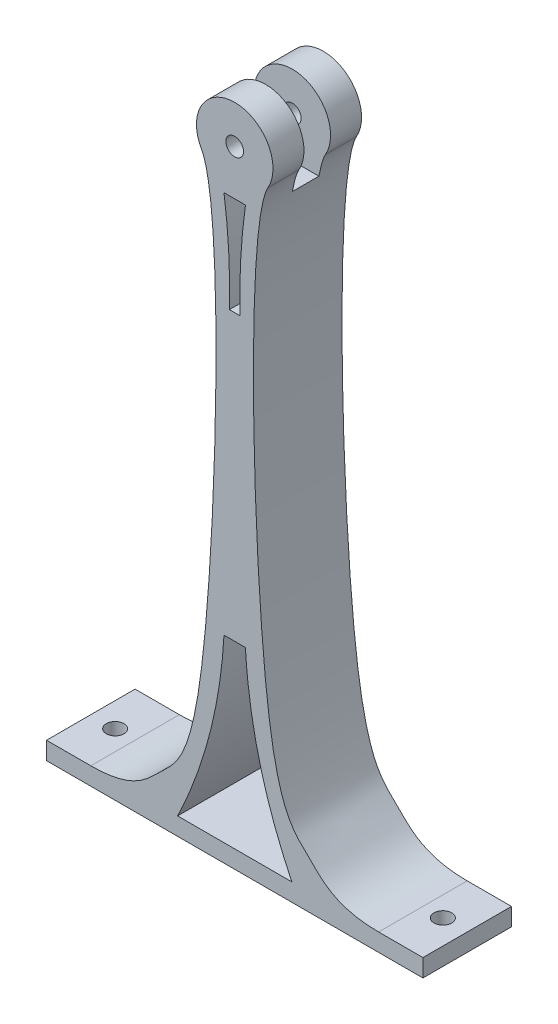
from build123d import *

# Parameters (mm, degrees)
SALIENTE_EXTRUIR2_DEPTH = 20
CROQUIS3_R              = 2
CORTAR_EXTRUIR1_DEPTH   = 158.182219231
CROQUIS7_W              = 30
CROQUIS7_H              = 6
CORTAR_EXTRUIR4_DEPTH   = 15
CROQUIS8_W              = 17.284402488
CROQUIS8_H              = 6
CORTAR_EXTRUIR5_DEPTH   = 5
CROQUIS6_R              = 2
CORTAR_EXTRUIR3_DEPTH   = 154.369651632


with BuildPart() as part:
    # Croquis1 → Saliente-Extruir2 (new body)
    with BuildSketch(Plane.XY):
        with BuildLine():
            Line((-42.5, 0), (-42.5, 4))
            Line((-42.5, 4), (-32.5, 4))
            add(Edge.make_bspline(
                [(-32.5, 4), (-22.670639358, 4), (-16.226990124, 12.301218675), (-5.122390032, 19.11443447), (-2.364282608, 128.09353499), (-7.5, 137.063891171)],
                knots=[0, 0, 0, 0, 0.22919519, 0.488952723, 0.855764583, 0.855764583, 0.855764583, 0.855764583], degree=3))
            ThreePointArc((-7.5, 137.063891171), (0, 150), (7.5, 137.063891171))
            add(Edge.make_bspline(
                [(32.5, 4), (22.670639358, 4), (16.226990124, 12.301218675), (5.122390032, 19.11443447), (2.364282608, 128.09353499), (7.5, 137.063891171)],
                knots=[0, 0, 0, 0, 0.22919519, 0.488952723, 0.855764583, 0.855764583, 0.855764583, 0.855764583], degree=3))
            Line((32.5, 4), (42.5, 4))
            Line((42.5, 4), (42.5, 0))
            Line((42.5, 0), (-42.5, 0))
        make_face()
    extrude(amount=SALIENTE_EXTRUIR2_DEPTH)

    # Croquis3 → Cortar-Extruir1 (cut, through all)
    with BuildSketch(Plane.XY.offset(20)):
        with Locations((0, 141.357798756)):
            Circle(CROQUIS3_R)
        with BuildLine():
            Line((-2.421642236, 44.591389295), (2.421642236, 44.591389295))
            add(Edge.make_bspline(
                [(12.896150466, 4), (3.6034191, 23.188396535), (2.421642236, 44.591389295)],
                knots=[0, 0, 0, 1, 1, 1], degree=2))
            Line((12.896150466, 4), (-12.896150466, 4))
            add(Edge.make_bspline(
                [(-12.896150466, 4), (-3.6034191, 23.188396535), (-2.421642236, 44.591389295)],
                knots=[0, 0, 0, 1, 1, 1], degree=2))
        make_face()
        with BuildLine():
            Line((-2.421642236, 131.126853852), (2.421642236, 131.126853852))
            add(Edge.make_bspline(
                [(2.421642236, 131.126853852), (0.876872729, 120.033282634), (1.210821118, 108.86049399)],
                knots=[0, 0, 0, 1, 1, 1], degree=2))
            Line((1.210821118, 108.86049399), (-1.210821118, 108.86049399))
            add(Edge.make_bspline(
                [(-2.421642236, 131.126853852), (-0.876872729, 120.033282634), (-1.210821118, 108.86049399)],
                knots=[0, 0, 0, 1, 1, 1], degree=2))
        make_face()
    extrude(amount=-CORTAR_EXTRUIR1_DEPTH, mode=Mode.SUBTRACT)

    # Croquis7 → Cortar-Extruir4 (cut)
    with BuildSketch(Plane(origin=(0, 137.063891171, 0), x_dir=(-1, 0, 0), z_dir=(0, -1, 0))):
        with Locations((0, -10)):
            Rectangle(CROQUIS7_W, CROQUIS7_H)
    extrude(amount=-CORTAR_EXTRUIR4_DEPTH, mode=Mode.SUBTRACT)

    # Croquis8 → Cortar-Extruir5 (cut)
    with BuildSketch(Plane(origin=(0, 137.063891171, 0), x_dir=(1, 0, 0), z_dir=(0, 1, 0))):
        with Locations((0, -10)):
            Rectangle(CROQUIS8_W, CROQUIS8_H)
    extrude(amount=-CORTAR_EXTRUIR5_DEPTH, mode=Mode.SUBTRACT)

    # Croquis6 → Cortar-Extruir3 (cut, through all)
    with BuildSketch(Plane(origin=(0, 4, 0), x_dir=(1, 0, 0), z_dir=(0, 1, 0))):
        with Locations(Location((-37, -10, 0), (0, 0, 270))):
            Circle(CROQUIS6_R)
        with Locations(Location((37, -10, 0), (0, 0, 90))):
            Circle(CROQUIS6_R)
    extrude(amount=-CORTAR_EXTRUIR3_DEPTH, mode=Mode.SUBTRACT)


solid = part.part
